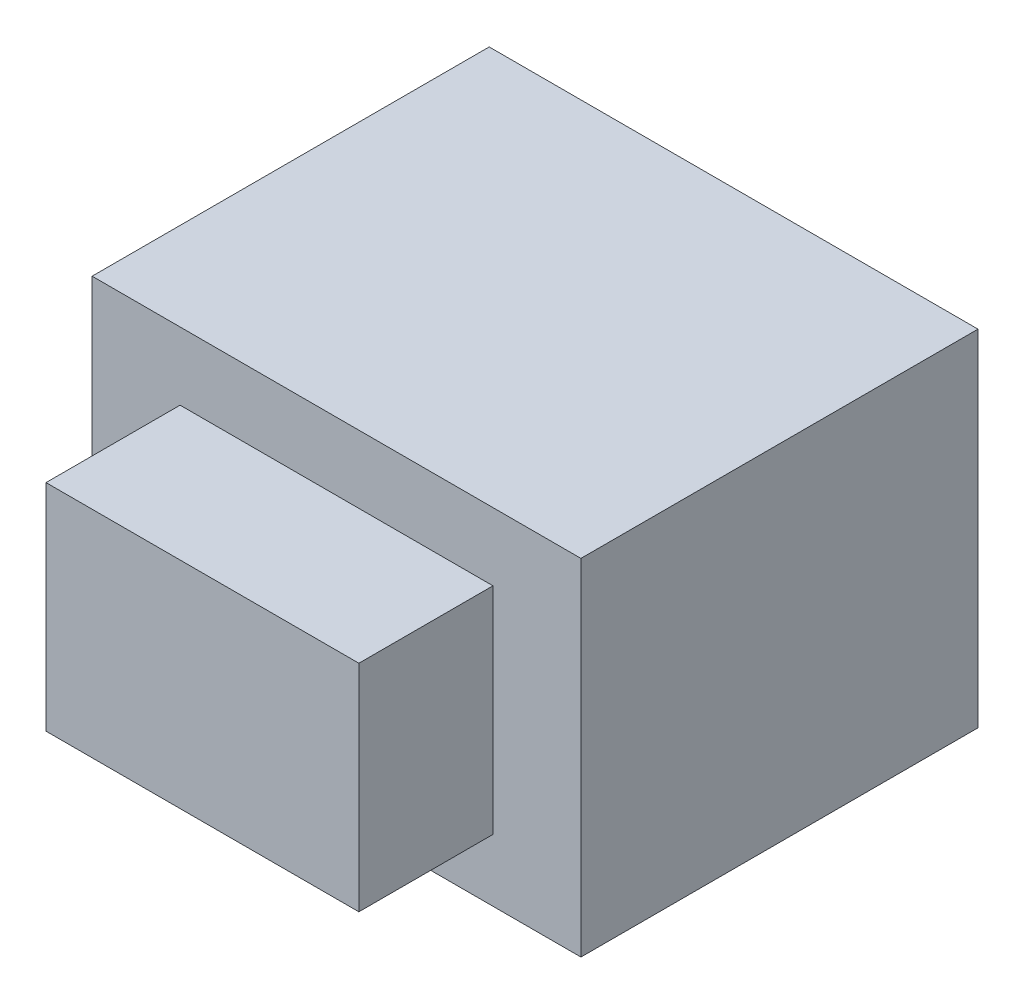
from build123d import *

# Parameters (mm, degrees)
SKETCH1_W           = 36.453071334
SKETCH1_H           = 29.61270878
BOSS_EXTRUDE1_DEPTH = 25.750300868
SKETCH3_W           = 23.333103548
SKETCH3_H           = 16.05594749
BOSS_EXTRUDE2_DEPTH = 10


with BuildPart() as part:
    # Sketch1 → Boss-Extrude1 (new body)
    with BuildSketch(Plane(origin=(0, 0, 0), x_dir=(1, 0, 0), z_dir=(0, 1, 0))):
        with Locations((18.226535667, 14.80635439)):
            Rectangle(SKETCH1_W, SKETCH1_H)
    extrude(amount=BOSS_EXTRUDE1_DEPTH)

    # Sketch3 → Boss-Extrude2 (add)
    with BuildSketch(Plane.XY):
        with Locations((18.226535667, 12.671057518)):
            Rectangle(SKETCH3_W, SKETCH3_H)
    extrude(amount=BOSS_EXTRUDE2_DEPTH)


solid = part.part
